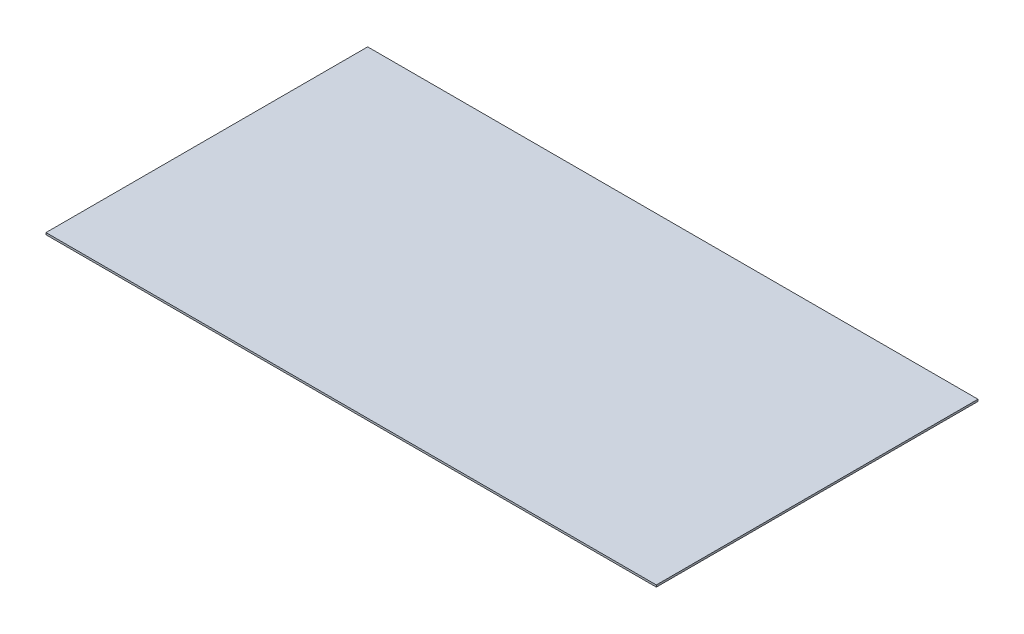
from build123d import *

# Parameters (mm, degrees)
SKETCH3_W           = 375.92
SKETCH3_H           = 1.1938
BOSS_EXTRUDE1_DEPTH = 99.06


with BuildPart() as part:
    # Sketch3 → Boss-Extrude1 (new, symmetric)
    with BuildSketch(Plane.XY):
        Rectangle(SKETCH3_W, SKETCH3_H)
    extrude(amount=BOSS_EXTRUDE1_DEPTH, both=True)


solid = part.part
